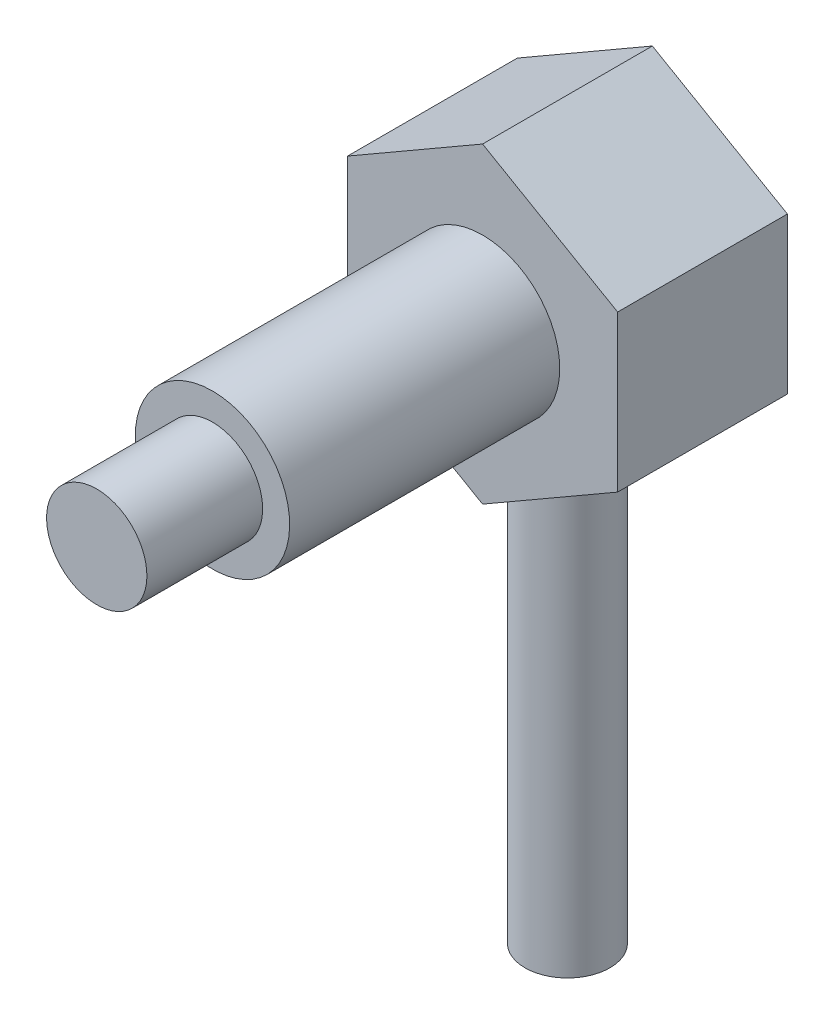
from build123d import *

# Parameters (mm, degrees)
EXTRUDE1_DEPTH = 4.4
SKETCH3_R      = 1.1
EXTRUDE2_DEPTH = 15


with BuildPart() as part:
    # Sketch1 → Extrude1 (new body)
    with BuildSketch(Plane.XY):
        Polygon((3.5, -2.020725942), (3.5, 2.020725942), (0, 4.041451884), (-3.5, 2.020725942), (-3.5, -2.020725942), (0, -4.041451884), align=None)
    extrude(amount=EXTRUDE1_DEPTH)

    # Sketch2 → Revolve1 (revolve)
    with BuildSketch(Plane(origin=(0, 0, 0), x_dir=(0, 0, -1), z_dir=(1, 0, 0))):
        Polygon((-14.4, 0), (-14.4, 1.3), (-11.4, 1.3), (-11.4, 2), (-4.4, 2), (-4.4, 0), align=None)
    revolve(axis=Axis((0, 0, 4.4), (0, 0, 1)))

    # Sketch3 → Extrude2 (add)
    with BuildSketch(Plane(origin=(0, 0, 0), x_dir=(1, 0, 0), z_dir=(0, 1, 0))):
        with Locations(Location((0, -2.2, 0), (0, 0, 270))):
            Circle(SKETCH3_R)
    extrude(amount=-EXTRUDE2_DEPTH)


solid = part.part
